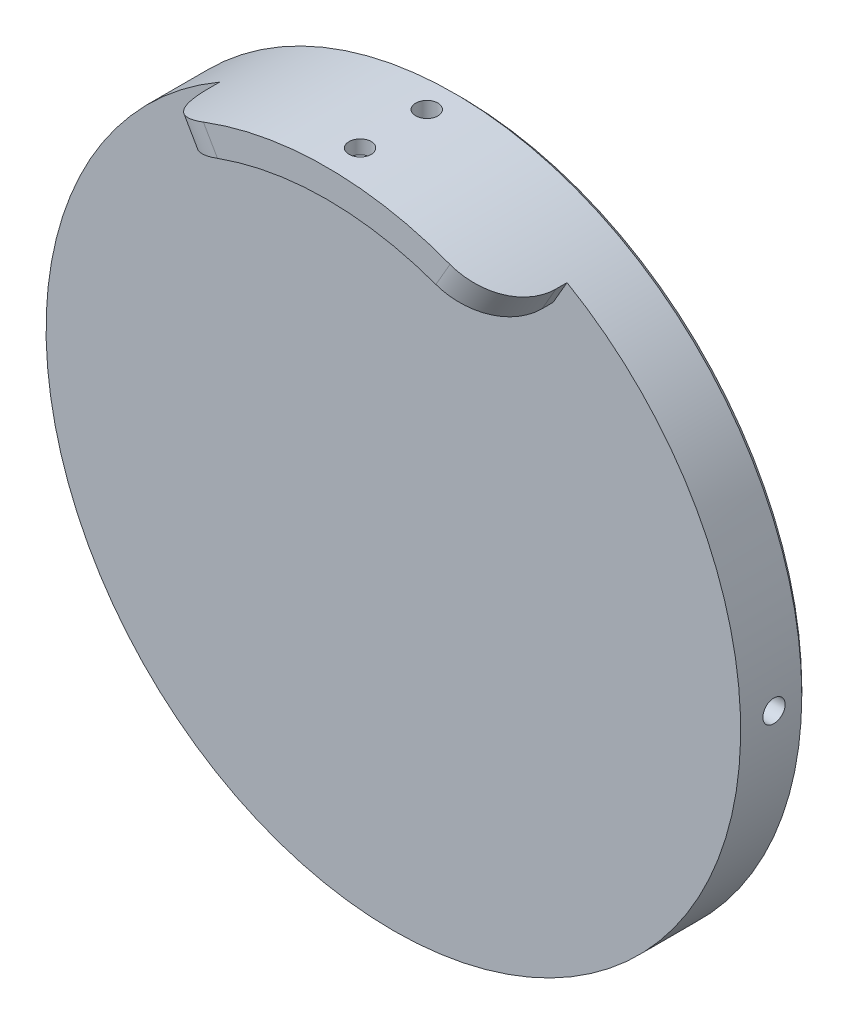
from build123d import *

# Parameters (mm, degrees)
SKETCH1_R           = 62.5
BOSS_EXTRUDE1_DEPTH = 6
CUT_EXTRUDE1_START  = 55
SKETCH2_R           = 2
CUT_EXTRUDE1_DEPTH  = 13
CUT_EXTRUDE2_START  = -68
SKETCH2_2_R         = 2
CUT_EXTRUDE2_DEPTH  = 13
CUT_EXTRUDE3_START  = 55
SKETCH3_R           = 2
CUT_EXTRUDE3_DEPTH  = 13
CUT_EXTRUDE4_START  = -68
SKETCH3_2_R         = 2
CUT_EXTRUDE4_DEPTH  = 13
BOSS_EXTRUDE2_START = 12
BOSS_EXTRUDE2_DEPTH = 12
FILLET1_R           = 10
CUT_EXTRUDE8_START  = 60
SKETCH6_R           = 2
CUT_EXTRUDE8_DEPTH  = 12.5
CHAMFER1_SIZE       = 1


with BuildPart() as part:
    # Sketch1 → Boss-Extrude1 (new, symmetric)
    with BuildSketch(Plane.XY):
        Circle(SKETCH1_R)
    extrude(amount=BOSS_EXTRUDE1_DEPTH, both=True)

    # Sketch2 → Cut-Extrude1 (cut)
    with BuildSketch(Plane(origin=(0, 0, 0), x_dir=(1, 0, 0), z_dir=(0, 1, 0)).offset(CUT_EXTRUDE1_START)):
        Circle(SKETCH2_R)
    extrude(amount=CUT_EXTRUDE1_DEPTH, mode=Mode.SUBTRACT)

    # Sketch2<2> → Cut-Extrude2 (cut)
    with BuildSketch(Plane(origin=(0, 0, 0), x_dir=(1, 0, 0), z_dir=(0, 1, 0)).offset(CUT_EXTRUDE2_START)):
        Circle(SKETCH2_2_R)
    extrude(amount=CUT_EXTRUDE2_DEPTH, mode=Mode.SUBTRACT)

    # Sketch3 → Cut-Extrude3 (cut)
    with BuildSketch(Plane(origin=(0, 0, 0), x_dir=(0, 0, -1), z_dir=(1, 0, 0)).offset(CUT_EXTRUDE3_START)):
        Circle(SKETCH3_R)
    extrude(amount=CUT_EXTRUDE3_DEPTH, mode=Mode.SUBTRACT)

    # Sketch3<2> → Cut-Extrude4 (cut)
    with BuildSketch(Plane(origin=(0, 0, 0), x_dir=(0, 0, -1), z_dir=(1, 0, 0)).offset(CUT_EXTRUDE4_START)):
        Circle(SKETCH3_2_R)
    extrude(amount=CUT_EXTRUDE4_DEPTH, mode=Mode.SUBTRACT)

    # Sketch5 → Boss-Extrude2 (add)
    with BuildSketch(Plane.XY.offset(6).offset(BOSS_EXTRUDE2_START)):
        with BuildLine():
            Line((-31.25, 54.126587737), (-28.75, 49.796460718))
            ThreePointArc((-28.75, 49.796460718), (0, 57.5), (28.75, 49.796460718))
            Line((28.75, 49.796460718), (31.25, 54.126587737))
            ThreePointArc((31.25, 54.126587737), (0, 62.5), (-31.25, 54.126587737))
        make_face()
    extrude(amount=-BOSS_EXTRUDE2_DEPTH)

    # Fillet1
    fillet1_edges = [part.edges().sort_by_distance(p)[0] for p in [
        (-30, 51.961524227, 18),
        (30, 51.961524227, 18),
    ]]
    fillet(fillet1_edges, radius=FILLET1_R)

    # Sketch6 → Cut-Extrude8 (cut)
    with BuildSketch(Plane(origin=(0, 0, 0), x_dir=(1, 0, 0), z_dir=(0, 1, 0)).offset(CUT_EXTRUDE8_START)):
        with Locations((0, -12)):
            Circle(SKETCH6_R)
    extrude(amount=CUT_EXTRUDE8_DEPTH, mode=Mode.SUBTRACT)

    # Chamfer1
    chamfer1_edges = [part.edges().sort_by_distance(p)[0] for p in [
        (-62.5, 0, -6),
    ]]
    chamfer(chamfer1_edges, length=CHAMFER1_SIZE)


solid = part.part
